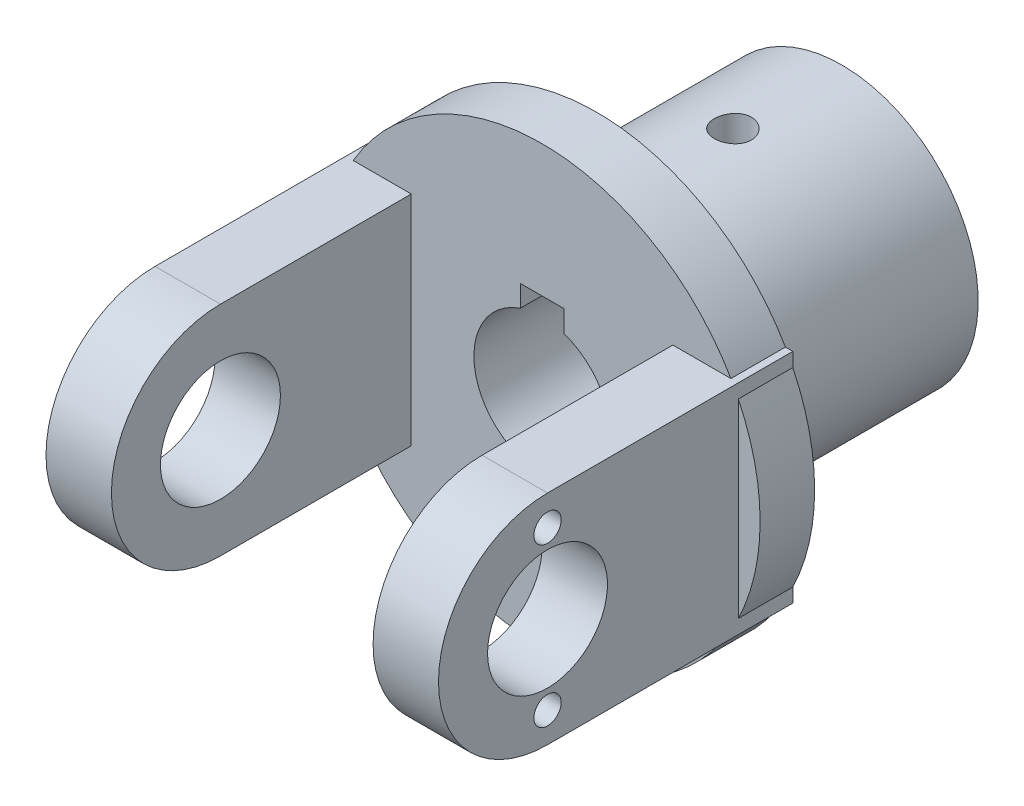
from build123d import *

# Parameters (mm, degrees)
EXTRUDE_1_DEPTH     = 12
SKETCH_3_R          = 11
CUT_EXTRUDE_1_DEPTH = 111
SKETCH_4_R          = 12.5
CUT_EXTRUDE_2_DEPTH = 124.693168769
SKETCH_5_W          = 8
SKETCH_5_H          = 15.8
CUT_EXTRUDE_3_DEPTH = 124.693168769
SKETCH_6_R          = 3.4
CUT_EXTRUDE_4_DEPTH = 13
SKETCH_7_R          = 2.5
CUT_EXTRUDE_5_DEPTH = 10


with BuildPart() as part:
    # 草图1 → 旋转1 (revolve)
    with BuildSketch(Plane(origin=(0, 0, 0), x_dir=(1, 0, 0), z_dir=(0, 1, 0)), mode=Mode.PRIVATE) as revolve_1_sk:
        Polygon((0, 0), (25, 0), (25, -45), (40, -45), (40, -55), (0, -55), align=None)
    revolve(revolve_1_sk.sketch.rotate(Axis((0, 0, 0), (0, 0, 1)), 180), axis=Axis((0, 0, 0), (0, 0, 1)))

    # 草图2 → 凸台-拉伸1 (add)
    with BuildSketch(Plane(origin=(24, 0, 0), x_dir=(0, 0, -1), z_dir=(1, 0, 0))):
        with BuildLine():
            Line((-45, -20), (-90, -20))
            ThreePointArc((-90, -20), (-110, 0), (-90, 20))
            Line((-90, 20), (-45, 20))
            Line((-45, 20), (-45, -20))
        make_face()
    extrude_1 = extrude(amount=EXTRUDE_1_DEPTH)

    # 镜向1: 凸台-拉伸1 across plane
    add(extrude_1.mirror(Plane(origin=(0, 0, 0), x_dir=(0, 0, 1), z_dir=(1, 0, 0))))

    # 草图3 → 切除-拉伸1 (cut, symmetric)
    with BuildSketch(Plane(origin=(0, 0, 0), x_dir=(0, 0, -1), z_dir=(1, 0, 0))):
        with Locations((-90, 0)):
            Circle(SKETCH_3_R)
    extrude(amount=CUT_EXTRUDE_1_DEPTH, both=True, mode=Mode.SUBTRACT)

    # 草图4 → 切除-拉伸2 (cut, through all)
    with BuildSketch(Plane.XY):
        with Locations(Location((0, 0, 0), (0, 0, 180))):
            Circle(SKETCH_4_R)
    extrude(amount=CUT_EXTRUDE_2_DEPTH, mode=Mode.SUBTRACT)

    # 草图5 → 切除-拉伸3 (cut, through all)
    with BuildSketch(Plane.XY):
        with Locations((0, 7.9)):
            Rectangle(SKETCH_5_W, SKETCH_5_H)
    extrude(amount=CUT_EXTRUDE_3_DEPTH, mode=Mode.SUBTRACT)

    # 草图6 → 切除-拉伸4 (cut)
    with BuildSketch(Plane(origin=(0, 25, 0), x_dir=(1, 0, 0), z_dir=(0, 1, 0))):
        with Locations(Location((0, -20, 0), (0, 0, 270))):
            Circle(SKETCH_6_R)
    extrude(amount=-CUT_EXTRUDE_4_DEPTH, mode=Mode.SUBTRACT)

    # 草图7 → 切除-拉伸5 (cut)
    with BuildSketch(Plane(origin=(36, 0, 0), x_dir=(0, 0, -1), z_dir=(1, 0, 0))):
        with Locations((-90, 14.5)):
            Circle(SKETCH_7_R)
        with Locations((-90, -14.5)):
            Circle(SKETCH_7_R)
    cut_extrude_5 = extrude(amount=-CUT_EXTRUDE_5_DEPTH, mode=Mode.SUBTRACT)

    # 镜向2: 切除-拉伸5 across plane
    add(cut_extrude_5.mirror(Plane(origin=(0, 0, 0), x_dir=(0, 0, 1), z_dir=(1, 0, 0))), mode=Mode.SUBTRACT)


solid = part.part
